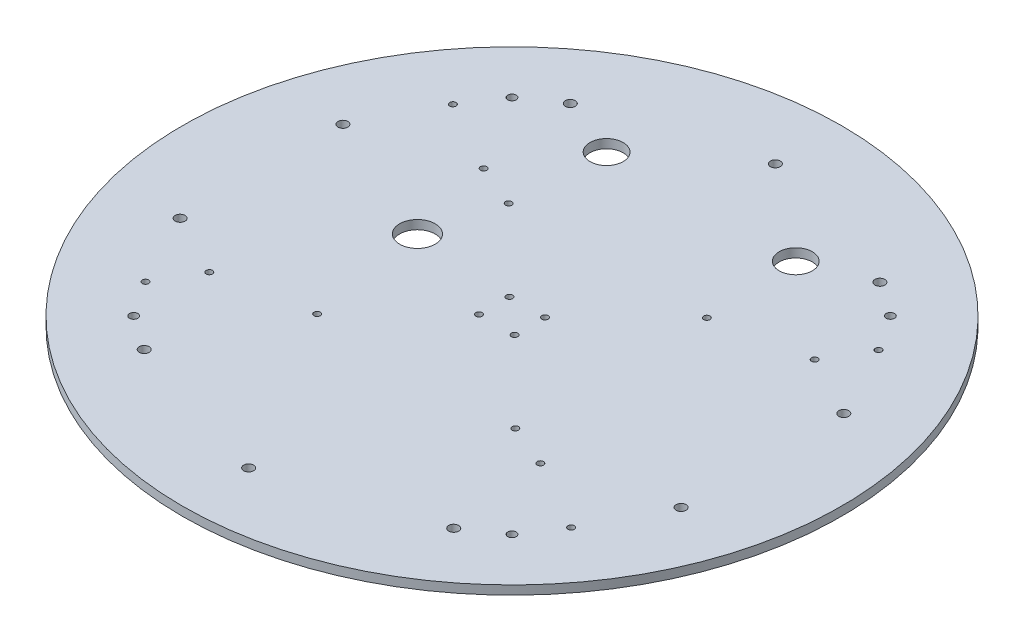
from build123d import *

# Parameters (mm, degrees)
SKETCH1_R                     = 177
SKETCH1_R_2                   = 2.2479
BOSS_EXTRUDE1_DEPTH           = 4.7625
SKETCH2_R                     = 1.7
JETSONHOLES_DEPTH             = 251.361102023
SKETCH3_R                     = 9.525
UART_WIRE_HOLE_DEPTH          = 251.361102023
SKETCH6_R                     = 1.7
SKETCH6_R_2                   = 8.89
NIMH_HOLES_DEPTH              = 251.361102023
SKETCH7_R                     = 1.7
IMU_HOLES_DEPTH               = 251.361102023
SKETCH8_R                     = 1.7
LEVEL2_3_STANDOFF_HOLES_DEPTH = 251.361102023
SKETCH9_R                     = 2.667
ZIP_TIES_DEPTH                = 251.361102023


with BuildPart() as part:
    # Sketch1 → Boss-Extrude1 (new body)
    with BuildSketch(Plane(origin=(0, 0, 0), x_dir=(1, 0, 0), z_dir=(0, 1, 0))):
        Circle(SKETCH1_R)
        with Locations((-101.6, -101.6)):
            Circle(SKETCH1_R_2, mode=Mode.SUBTRACT)
        with Locations((-101.6, 101.6)):
            Circle(SKETCH1_R_2, mode=Mode.SUBTRACT)
        with Locations((101.6, 101.6)):
            Circle(SKETCH1_R_2, mode=Mode.SUBTRACT)
        with Locations((101.6, -101.6)):
            Circle(SKETCH1_R_2, mode=Mode.SUBTRACT)
    extrude(amount=BOSS_EXTRUDE1_DEPTH)

    # Sketch2 → JetsonHoles (cut, through all)
    with BuildSketch(Plane(origin=(0, 4.7625, 0), x_dir=(1, 0, 0), z_dir=(0, 1, 0))):
        with Locations((-53.213, 51.435)):
            Circle(SKETCH2_R)
        with Locations((53.213, 51.435)):
            Circle(SKETCH2_R)
        with Locations((-53.213, -51.435)):
            Circle(SKETCH2_R)
        with Locations((53.213, -51.435)):
            Circle(SKETCH2_R)
    extrude(amount=-JETSONHOLES_DEPTH, mode=Mode.SUBTRACT)

    # Sketch3 → UART-Wire-Hole (cut, through all)
    with BuildSketch(Plane(origin=(0, 4.7625, 0), x_dir=(1, 0, 0), z_dir=(0, 1, 0))):
        with Locations((-63.5, 12.7)):
            Circle(SKETCH3_R)
    extrude(amount=-UART_WIRE_HOLE_DEPTH, mode=Mode.SUBTRACT)

    # Sketch6 → NiMH_Holes (cut, through all)
    with BuildSketch(Plane(origin=(0, 4.7625, 0), x_dir=(1, 0, 0), z_dir=(0, 1, 0))):
        with Locations((101.6, 60.96)):
            Circle(SKETCH6_R)
        with Locations((76.2, -60.96)):
            Circle(SKETCH6_R)
        with Locations((-101.6, -60.96)):
            Circle(SKETCH6_R)
        with Locations((-76.2, 60.96)):
            Circle(SKETCH6_R)
        with Locations((-50.8, 101.6)):
            Circle(SKETCH6_R_2)
        with Locations((50.8, 101.6)):
            Circle(SKETCH6_R_2)
    extrude(amount=-NIMH_HOLES_DEPTH, mode=Mode.SUBTRACT)

    # Sketch7 → IMU_Holes (cut, through all)
    with BuildSketch(Plane(origin=(0, 4.7625, 0), x_dir=(1, 0, 0), z_dir=(0, 1, 0))):
        with Locations((-9.55000005, 8.162499942)):
            Circle(SKETCH7_R)
        with Locations((9.54999995, 8.162499942)):
            Circle(SKETCH7_R)
        with Locations((-9.55000005, -8.162500058)):
            Circle(SKETCH7_R)
        with Locations((9.54999995, -8.162500058)):
            Circle(SKETCH7_R)
    extrude(amount=-IMU_HOLES_DEPTH, mode=Mode.SUBTRACT)

    # Sketch8 → Level2_3_Standoff_holes (cut, through all)
    with BuildSketch(Plane(origin=(0, 4.7625, 0), x_dir=(1, 0, 0), z_dir=(0, 1, 0))):
        with Locations((-114.3, -82.55)):
            Circle(SKETCH8_R)
        with Locations((-114.3, 82.55)):
            Circle(SKETCH8_R)
        with Locations((114.3, 82.55)):
            Circle(SKETCH8_R)
        with Locations((114.3, -82.55)):
            Circle(SKETCH8_R)
    extrude(amount=-LEVEL2_3_STANDOFF_HOLES_DEPTH, mode=Mode.SUBTRACT)

    # Sketch9 → Zip Ties (cut, through all)
    with BuildSketch(Plane(origin=(0, 4.7625, 0), x_dir=(1, 0, 0), z_dir=(0, 1, 0))):
        with Locations((0, -141.44)):
            Circle(SKETCH9_R)
        with Locations((-83.136346084, -114.427363684)):
            Circle(SKETCH9_R)
        with Locations((-134.517433665, -43.707363684)):
            Circle(SKETCH9_R)
        with Locations((-134.517433665, 43.707363684)):
            Circle(SKETCH9_R)
        with Locations((-83.136346084, 114.427363684)):
            Circle(SKETCH9_R)
        with Locations((0, 141.44)):
            Circle(SKETCH9_R)
        with Locations((83.136346084, 114.427363684)):
            Circle(SKETCH9_R)
        with Locations((134.517433665, 43.707363684)):
            Circle(SKETCH9_R)
        with Locations((134.517433665, -43.707363684)):
            Circle(SKETCH9_R)
        with Locations((83.136346084, -114.427363684)):
            Circle(SKETCH9_R)
    extrude(amount=-ZIP_TIES_DEPTH, mode=Mode.SUBTRACT)


solid = part.part
